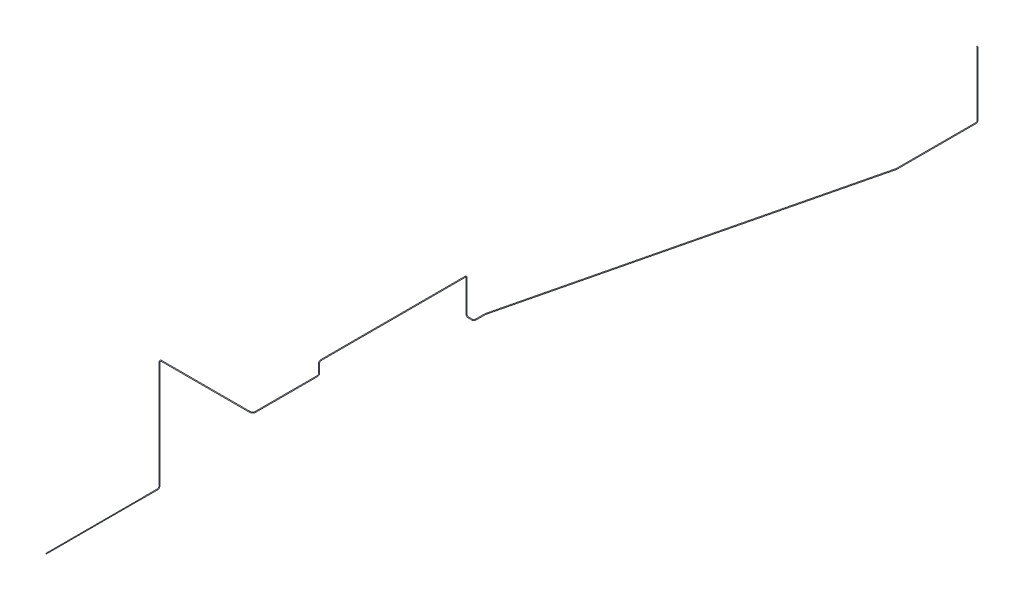
from build123d import *

# Parameters (mm, degrees)
CROQUIS1_R              = 12.7
SALIENTE_EXTRUIR1_DEPTH = 4000
CROQUIS4_R              = 16


with BuildPart() as part:
    # Croquis1 → Saliente-Extruir1 (new body)
    with BuildSketch(Plane.XY):
        Circle(CROQUIS1_R)
    extrude(amount=-SALIENTE_EXTRUIR1_DEPTH)

    # Barrer4: sweep along a curve in space
    with BuildLine() as barrer4_path:
        Line((0, 0, -4000), (0, 0, -4590))
        ThreePointArc((0, 0, -4590), (0, 26.360389693, -4653.639610307), (0, 90, -4680))
        Line((0, 90, -4680), (0, 4510, -4680))
        ThreePointArc((0, 4510, -4680), (26.360389693, 4573.639610307, -4680), (90, 4600, -4680))
        Line((90, 4600, -4680), (3730, 4600, -4680))
        ThreePointArc((3730, 4600, -4680), (3814.852813742, 4600, -4715.147186258), (3850, 4600, -4800))
        Line((3850, 4600, -4800), (3850, 4600, -7370))
        ThreePointArc((3850, 4600, -7370), (3850, 4617.573593129, -7412.426406871), (3850, 4660, -7430))
        Line((3850, 4660, -7430), (3850, 5040, -7430))
        ThreePointArc((3850, 5040, -7430), (3850, 5082.426406871, -7447.573593129), (3850, 5100, -7490))
        Line((3850, 5100, -7490), (3850, 5100, -13470))
        ThreePointArc((3850, 5100, -13470), (3850, 5082.426406871, -13512.426406871), (3850, 5040, -13530))
        Line((3850, 5040, -13530), (3850, 3710, -13530))
        ThreePointArc((3850, 3710, -13530), (3867.573593129, 3667.573593129, -13530), (3910, 3650, -13530))
        Line((3910, 3650, -13530), (4090, 3650, -13530))
        ThreePointArc((4090, 3650, -13530), (4132.426406871, 3650, -13547.573593129), (4150, 3650, -13590))
        Line((4150, 3650, -13590), (4150, 3650, -13994.222657108))
        ThreePointArc((4150, 3650, -13994.222657108), (4150, 3649.723771902, -13999.973402259), (4150, 3648.897631007, -14005.671196831))
        Line((4150, 3648.897631007, -14005.671196831), (4150, 346.637113652, -30994.328803169))
        ThreePointArc((4150, 345.534744659, -31005.777342892), (4150, 345.810972757, -31000.026597741), (4150, 346.637113652, -30994.328803169))
        Line((4150, 345.534744659, -31005.777342892), (4150, 345.534744659, -34290))
        ThreePointArc((4150, 345.534744659, -34290), (4150, 363.108337788, -34332.426406871), (4150, 405.534744659, -34350))
        Line((4150, 405.534744659, -34350), (4150, 3028.534744659, -34350))
        ThreePointArc((4150, 3028.534744659, -34350), (4145.02081528, 3040.555559939, -34350), (4133, 3045.534744659, -34350))
        Line((4133, 3045.534744659, -34350), (4130, 3045.534744659, -34350))
    # Croquis4 → Barrer4 (sweep)
    with BuildSketch(Plane(origin=(0, 0, -4000), x_dir=(-1, 0, 0), z_dir=(0, 0, -1))):
        Circle(CROQUIS4_R)
    sweep(path=barrer4_path.line)


solid = part.part
